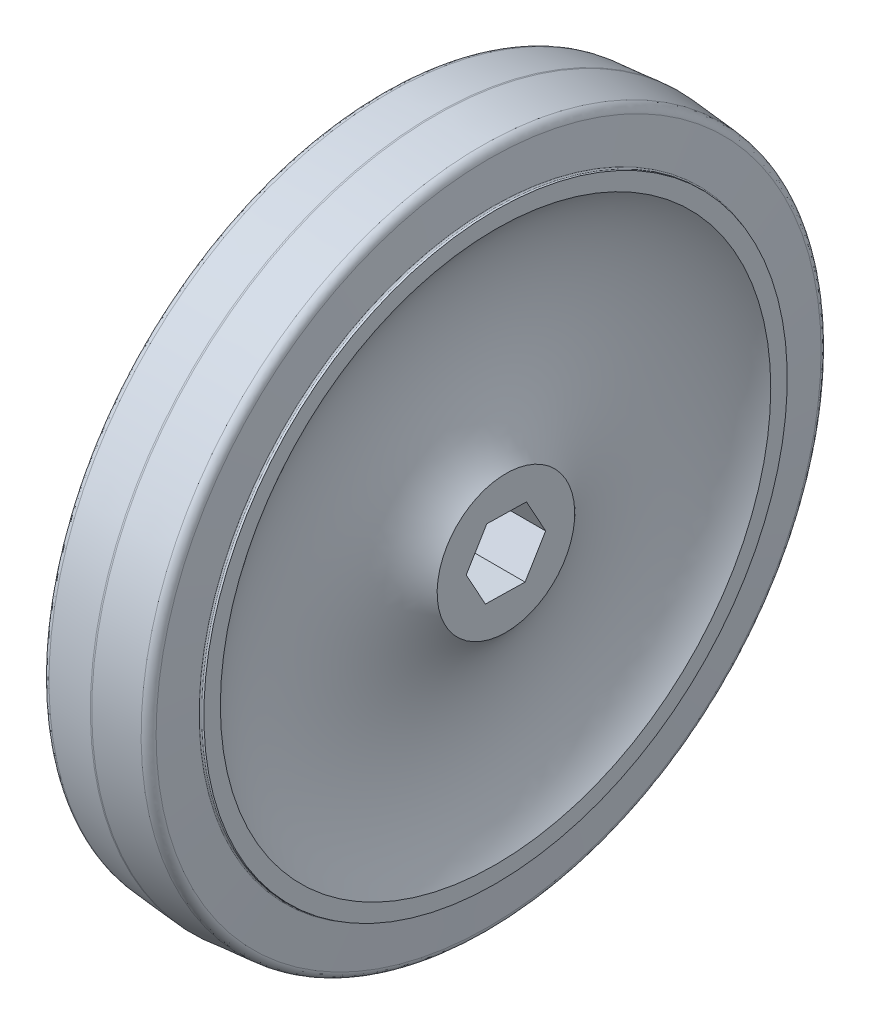
from build123d import *

# Parameters (mm, degrees)
BOSS_EXTRUDE4_START = -26.19375
SKETCH2_R           = 7.683499998
BOSS_EXTRUDE4_DEPTH = 26.19375


with BuildPart() as part:
    # Sketch1 → Revolve1 (revolve)
    with BuildSketch(Plane(origin=(0, 0, 0), x_dir=(-1, 0, 0), z_dir=(0, 0, -1)), mode=Mode.PRIVATE) as revolve1_sk:
        with BuildLine():
            Line((-0.132825357, 63.488379281), (-8.505078341, 62.755902063))
            add(Edge.make_bspline(
                [(-9.890453705, 61.370526691), (-9.833534714, 62.02111377), (-9.155665405, 62.698983073), (-8.505078341, 62.755902063)],
                knots=[0, 0, 0, 0, 1, 1, 1, 1], degree=3))
            Line((-9.890453705, 61.370526691), (-10.528304174, 54.079862443))
            add(Edge.make_bspline(
                [(-10.528304174, 54.079862443), (-10.53827479, 53.96589783), (-10.666937682, 53.848000004), (-10.781337635, 53.848000004)],
                knots=[0, 0, 0, 0, 1, 1, 1, 1], degree=3))
            Line((-10.781337635, 53.848000004), (-11.176, 53.848000004))
            Line((-11.176, 53.848000004), (-11.176, 50.800000019))
            add(Edge.make_bspline(
                [(-11.176, 50.800000019), (-3.189225626, 40.905049069), (-4.153716896, 21.742970834), (-13.09370001, 12.700000013)],
                knots=[0, 0, 0, 0, 1, 1, 1, 1], degree=3))
            Line((-13.09370001, 12.700000013), (-13.09370001, 7.683499998))
            Line((-13.09370001, 7.683499998), (13.093700011, 7.683499998))
            Line((13.093700011, 7.683499998), (13.093700011, 12.700000006))
            add(Edge.make_bspline(
                [(13.093700011, 12.700000006), (4.153716897, 21.742970827), (3.189225626, 40.905049061), (11.176, 50.800000012)],
                knots=[0, 0, 0, 0, 1, 1, 1, 1], degree=3))
            Line((11.176, 50.800000012), (11.176, 53.848000004))
            Line((11.176, 53.848000004), (10.781337638, 53.848000004))
            add(Edge.make_bspline(
                [(10.781337638, 53.848000004), (10.666937685, 53.848000005), (10.538274794, 53.96589783), (10.528304179, 54.079862443)],
                knots=[0, 0, 0, 0, 1, 1, 1, 1], degree=3))
            Line((10.528304179, 54.079862443), (9.890453706, 61.370526682))
            add(Edge.make_bspline(
                [(8.505078343, 62.755902055), (9.155665407, 62.698983064), (9.833534715, 62.021113761), (9.890453706, 61.370526682)],
                knots=[0, 0, 0, 0, 1, 1, 1, 1], degree=3))
            Line((8.505078343, 62.755902055), (0.13282536, 63.488379281))
            add(Edge.make_bspline(
                [(-0.132825357, 63.488379281), (-0.044612079, 63.496096943), (0.044612082, 63.496096943), (0.13282536, 63.488379281)],
                knots=[0, 0, 0, 0, 1, 1, 1, 1], degree=3))
        make_face()
    revolve(revolve1_sk.sketch.rotate(Axis((14.707172977, 0, 0), (-1, 0, 0)), 180), axis=Axis((14.707172977, 0, 0), (-1, 0, 0)))

    # Sketch2 → Boss-Extrude4 (add)
    with BuildSketch(Plane(origin=(13.09370001, 0, 0), x_dir=(0, 0, -1), z_dir=(1, 0, 0)).offset(BOSS_EXTRUDE4_START)):
        with Locations(Location((0, 0, 0), (0, 0, 90))):
            Circle(SKETCH2_R)
        Polygon((7.3308373, -0.148855003), (3.794330864, 6.274263831), (-3.536506436, 6.423118835), (-7.3308373, 0.148855003), (-3.794330864, -6.274263831), (3.536506436, -6.423118835), align=None, mode=Mode.SUBTRACT)
    extrude(amount=BOSS_EXTRUDE4_DEPTH)


solid = part.part
